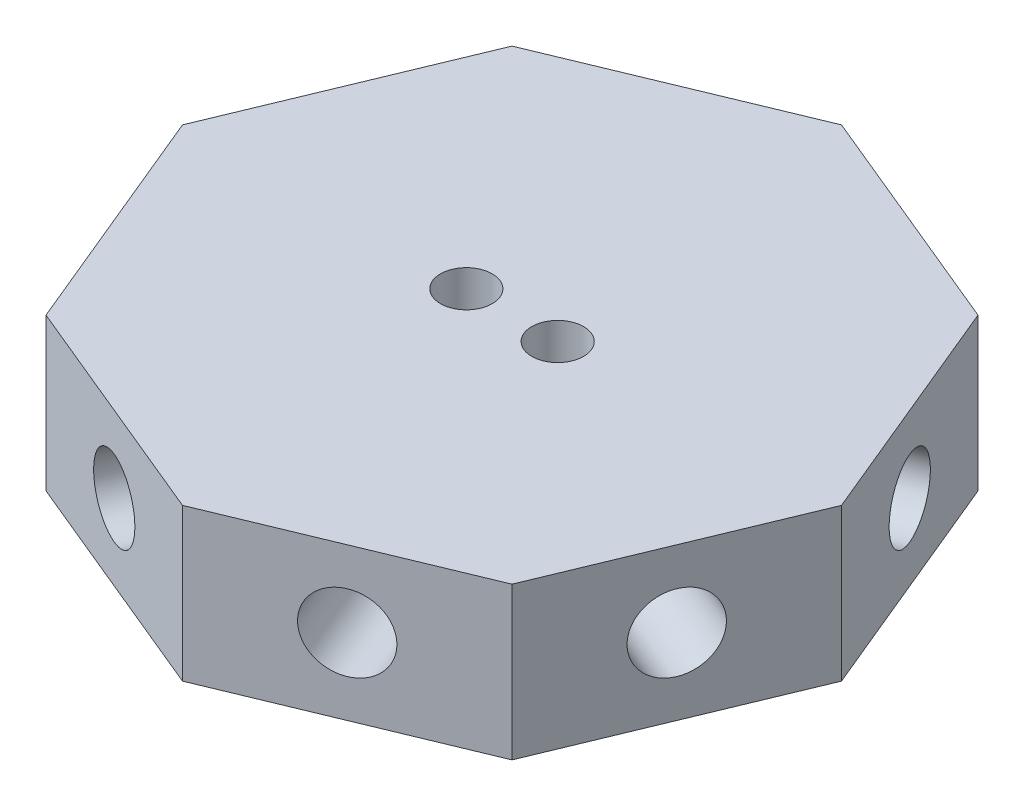
from build123d import *

# Parameters (mm, degrees)
SKETCH1_R           = 1.0795
BOSS_EXTRUDE1_DEPTH = 6.35
SKETCH2_R           = 1.5875
CUT_EXTRUDE1_DEPTH  = 7.62
CIRPATTERN1_COUNT   = 8


with BuildPart() as part:
    # Sketch1 → Boss-Extrude1 (new body)
    with BuildSketch(Plane(origin=(0, 0, 0), x_dir=(1, 0, 0), z_dir=(0, 1, 0))):
        Polygon((0, 13.746380944), (-9.720159182, 9.720159182), (-13.746380944, 0), (-9.720159182, -9.720159182), (0, -13.746380944), (9.720159182, -9.720159182), (13.746380944, 0), (9.720159182, 9.720159182), align=None)
        with Locations(Location((1.905, 0, 0), (0, 0, 270))):
            Circle(SKETCH1_R, mode=Mode.SUBTRACT)
        with Locations(Location((-1.905, 0, 0), (0, 0, 270))):
            Circle(SKETCH1_R, mode=Mode.SUBTRACT)
    extrude(amount=BOSS_EXTRUDE1_DEPTH)

    # Sketch2 → Cut-Extrude1 (cut)
    with BuildSketch(Plane(origin=(-4.860079591, 0, 11.733270063), x_dir=(0.9238795325112905, 0, 0.3826834323650806), z_dir=(-0.3826834323650806, 0, 0.9238795325112905))):
        with Locations((0, 3.175)):
            Circle(SKETCH2_R)
    cut_extrude1 = extrude(amount=-CUT_EXTRUDE1_DEPTH, mode=Mode.SUBTRACT)

    # CirPattern1: Cut-Extrude1 ×8 about axis
    cirpattern1_axis = Axis((0, 0, 0), (0, 1, 0))
    for i in range(1, CIRPATTERN1_COUNT):
        add(cut_extrude1.rotate(cirpattern1_axis, i * 360 / CIRPATTERN1_COUNT), mode=Mode.SUBTRACT)


solid = part.part
